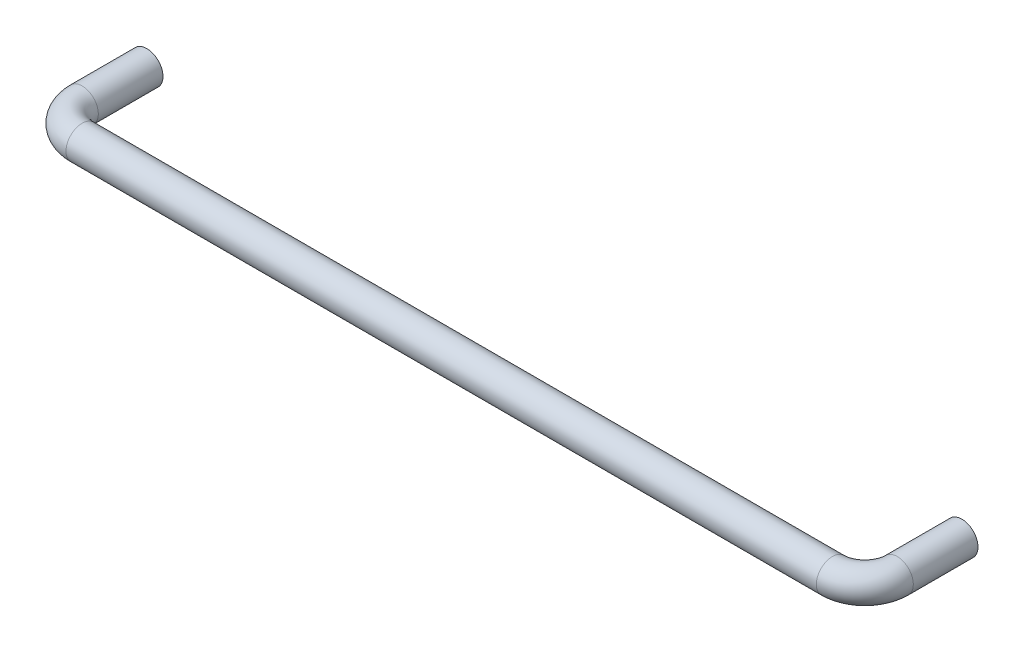
from build123d import *

# Parameters (mm, degrees)
SKETCH1_R                          = 5
M3_0_3_000000_DIAMETER_HOLE1_D     = 3
M3_0_3_000000_DIAMETER_HOLE1_DEPTH = 3
M3_0_3_000000_DIAMETER_HOLE1_TIP   = 0.901290929


with BuildPart() as part:
    # Base-Sweep: sweep along a curve in space
    with BuildLine() as base_sweep_path:
        Line((0, 0, 0), (0, 0, 20))
        ThreePointArc((0, 0, 20), (2.928932188, 0, 27.071067812), (10, 0, 30))
        Line((10, 0, 30), (126, 0, 30))
    # Sketch1 → Base-Sweep (sweep)
    with BuildSketch(Plane.XY):
        Circle(SKETCH1_R)
    sweep(path=base_sweep_path.line)

    # M3.0 (3.000000) Diameter Hole1
    with Locations(Plane(origin=(0, 0, 0), x_dir=(-1, 0, 0), z_dir=(0, 0, -1))):
        with Locations((0, 0)):
            Hole(M3_0_3_000000_DIAMETER_HOLE1_D / 2, depth=M3_0_3_000000_DIAMETER_HOLE1_DEPTH)
            with Locations((0, 0, -(M3_0_3_000000_DIAMETER_HOLE1_DEPTH + M3_0_3_000000_DIAMETER_HOLE1_TIP / 2))):  # 118° drill point
                Cone(0, M3_0_3_000000_DIAMETER_HOLE1_D / 2, M3_0_3_000000_DIAMETER_HOLE1_TIP, mode=Mode.SUBTRACT)

    # Mirror All1: part across face


with BuildPart() as part_1:
    add(part.part)
    add(part.part.mirror(Plane(origin=(126, 0, 30), x_dir=(0, 0, 1), z_dir=(1, 0, 0))))


solid = part_1.part
